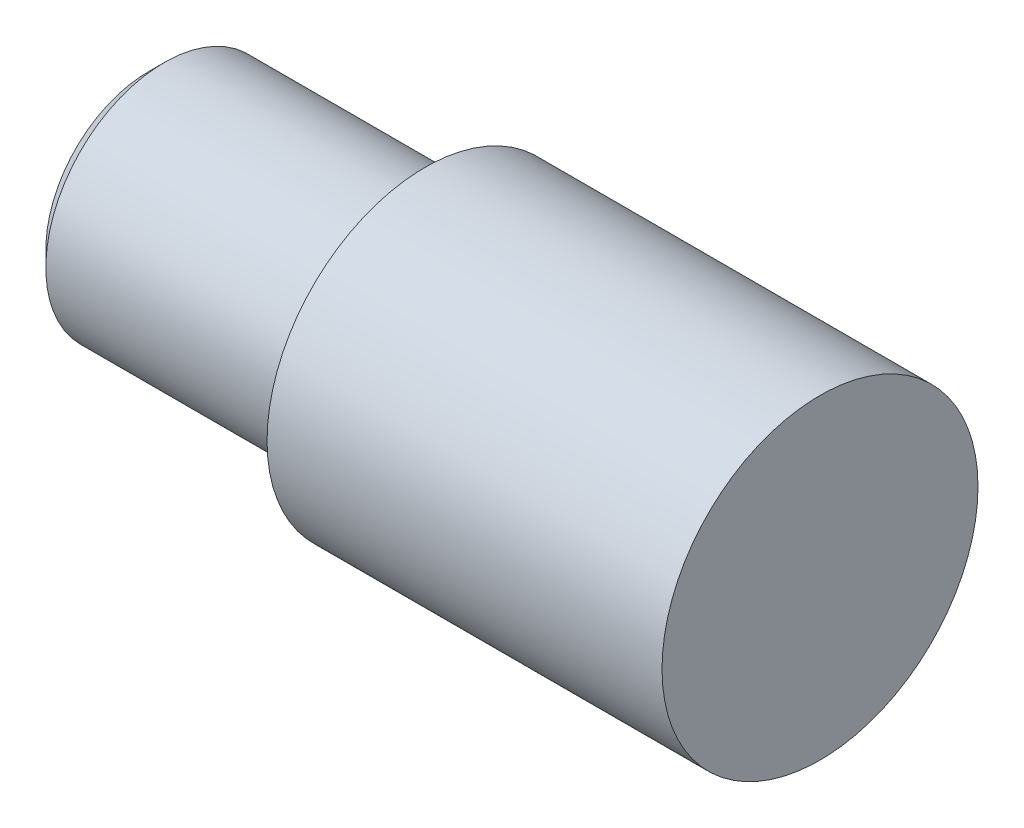
from build123d import *

# Parameters (mm, degrees)
SKETCH1_R           = 2
BOSS_EXTRUDE1_DEPTH = 5
SKETCH2_R           = 1.5
BOSS_EXTRUDE2_DEPTH = 3.5
CHAMFER1_SIZE       = 0.2


with BuildPart() as part:
    # Sketch1 → Boss-Extrude1 (new body)
    with BuildSketch(Plane(origin=(0, 0, 0), x_dir=(0, 0, -1), z_dir=(1, 0, 0))):
        Circle(SKETCH1_R)
    extrude(amount=BOSS_EXTRUDE1_DEPTH)

    # Sketch2 → Boss-Extrude2 (add)
    with BuildSketch(Plane.ZY):
        with Locations(Location((0, 0, 0), (0, 0, 180))):
            Circle(SKETCH2_R)
    extrude(amount=BOSS_EXTRUDE2_DEPTH)

    # Chamfer1
    chamfer1_edges = [part.edges().sort_by_distance(p)[0] for p in [
        (-3.5, 0, 1.5),
    ]]
    chamfer(chamfer1_edges, length=CHAMFER1_SIZE)


solid = part.part
